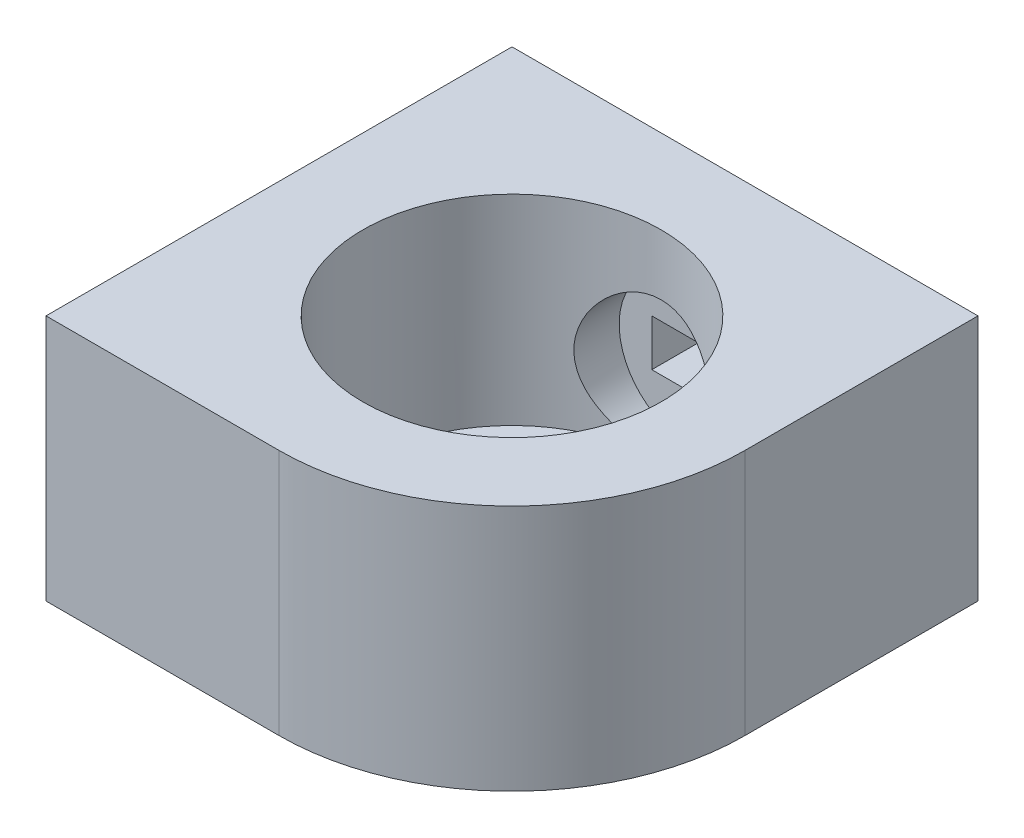
from build123d import *

# Parameters (mm, degrees)
SKETCH1_R           = 16
BOSS_EXTRUDE1_DEPTH = 26.5
SKETCH1_3_R         = 16
BOSS_EXTRUDE2_DEPTH = 5
SKETCH2_R           = 2
CUT_EXTRUDE1_DEPTH  = 5
SKETCH3_R           = 2.55
CUT_EXTRUDE2_DEPTH  = 5
SKETCH5_R           = 7.5
CUT_EXTRUDE8_DEPTH  = 19
SKETCH6_W           = 8
SKETCH6_H           = 5
CUT_EXTRUDE9_DEPTH  = 19


with BuildPart() as part:
    # Sketch1 → Boss-Extrude1 (new body)
    with BuildSketch(Plane(origin=(0, 0, 0), x_dir=(1, 0, 0), z_dir=(0, 1, 0))):
        with BuildLine():
            Line((-25, 25), (-25, -25))
            Line((-25, -25), (0, -25))
            ThreePointArc((0, -25), (17.67766953, -17.67766953), (25, 0))
            Line((25, 0), (25, 25))
            Line((25, 25), (-25, 25))
        make_face()
        Circle(SKETCH1_R, mode=Mode.SUBTRACT)
    extrude(amount=BOSS_EXTRUDE1_DEPTH)

    # Sketch1<3> → Boss-Extrude2 (add)
    with BuildSketch(Plane(origin=(0, 0, 0), x_dir=(1, 0, 0), z_dir=(0, 1, 0))):
        Circle(SKETCH1_3_R)
    extrude(amount=BOSS_EXTRUDE2_DEPTH)

    # Sketch2 → Cut-Extrude1 (cut)
    with BuildSketch(Plane(origin=(0, 5, 0), x_dir=(1, 0, 0), z_dir=(0, 1, 0))):
        Circle(SKETCH2_R)
    extrude(amount=-CUT_EXTRUDE1_DEPTH, mode=Mode.SUBTRACT)

    # Sketch3 → Cut-Extrude2 (cut)
    with BuildSketch(Plane.ZY.offset(25)):
        with Locations((0, 15)):
            Circle(SKETCH3_R)
    extrude(amount=-CUT_EXTRUDE2_DEPTH, mode=Mode.SUBTRACT)

    # Sketch5 → Cut-Extrude8 (cut)
    with BuildSketch(Plane.XY):
        with Locations((0, 12.5)):
            Circle(SKETCH5_R)
    extrude(amount=-CUT_EXTRUDE8_DEPTH, mode=Mode.SUBTRACT)

    # Sketch6 → Cut-Extrude9 (cut)
    with BuildSketch(Plane.XY.offset(-19)):
        with Locations((0, 12.5)):
            Rectangle(SKETCH6_W, SKETCH6_H)
    extrude(amount=-CUT_EXTRUDE9_DEPTH, mode=Mode.SUBTRACT)


solid = part.part
